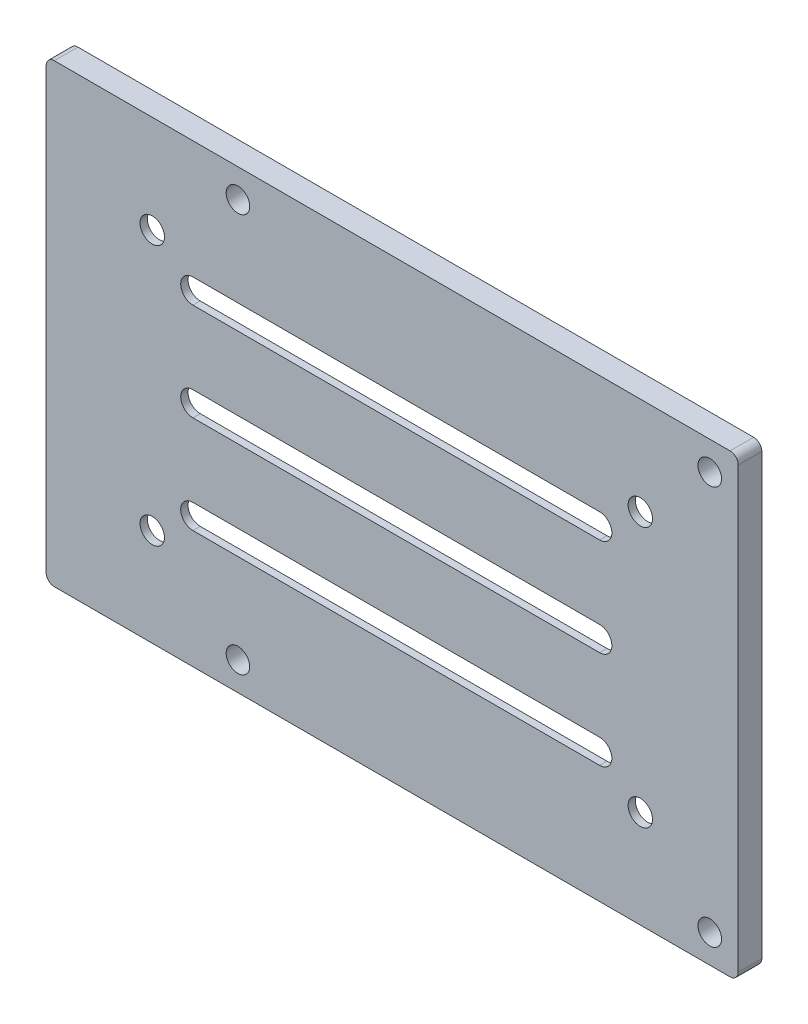
from build123d import *

# Parameters (mm, degrees)
SKETCH1_W           = 85.073492716
SKETCH1_H           = 56
SKETCH1_R           = 1.45
SKETCH1_R_2         = 1.444439883
BOSS_EXTRUDE2_DEPTH = 2.9
FILLET1_R           = 1
SKETCH2_W           = 74.073492716
SKETCH2_H           = 42
CUT_EXTRUDE1_DEPTH  = 2
SKETCH3_R           = 1.5
CUT_EXTRUDE2_DEPTH  = 13


with BuildPart() as part:
    # Sketch1 → Boss-Extrude2 (new body)
    with BuildSketch(Plane.XY):
        with Locations((0.5, -16.452272815)):
            Rectangle(SKETCH1_W, SKETCH1_H)
        with Locations((39.536746358, 8.047727185)):
            Circle(SKETCH1_R, mode=Mode.SUBTRACT)
        with Locations((39.536746358, -40.952272815)):
            Circle(SKETCH1_R, mode=Mode.SUBTRACT)
        with Locations((-18.463253642, 8.047727185)):
            Circle(SKETCH1_R, mode=Mode.SUBTRACT)
        with Locations((-18.463253642, -40.952272815)):
            Circle(SKETCH1_R_2, mode=Mode.SUBTRACT)
    extrude(amount=BOSS_EXTRUDE2_DEPTH)

    # Fillet1
    fillet1_edges = [part.edges().sort_by_distance(p)[0] for p in [
        (-42.036746358, 11.547727185, 1.45),
        (43.036746358, 11.547727185, 1.45),
        (43.036746358, -44.452272815, 1.45),
        (-42.036746358, -44.452272815, 1.45),
    ]]
    fillet(fillet1_edges, radius=FILLET1_R)

    # Sketch2 → Cut-Extrude1 (cut)
    with BuildSketch(Plane(origin=(0, 0, 0), x_dir=(-1, 0, 0), z_dir=(0, 0, -1))):
        with Locations((-1, -16.452272815)):
            Rectangle(SKETCH2_W, SKETCH2_H)
    extrude(amount=-CUT_EXTRUDE1_DEPTH, mode=Mode.SUBTRACT)

    # Sketch3 → Cut-Extrude2 (cut)
    with BuildSketch(Plane(origin=(0, 0, 2), x_dir=(-1, 0, 0), z_dir=(0, 0, -1))):
        with Locations((-31, -0.452272815)):
            Circle(SKETCH3_R)
        with Locations((-31, -32.452272815)):
            Circle(SKETCH3_R)
        with Locations((29, -32.452272815)):
            Circle(SKETCH3_R)
        with Locations((29, -0.452272815)):
            Circle(SKETCH3_R)
        with BuildLine():
            Line((-26, -2.952272815), (24, -2.952272815))
            ThreePointArc((24, -2.952272815), (25.5, -4.452272815), (24, -5.952272815))
            Line((24, -5.952272815), (-26, -5.952272815))
            ThreePointArc((-26, -5.952272815), (-27.5, -4.452272815), (-26, -2.952272815))
        make_face()
        with BuildLine():
            Line((-26, -29.952272815), (24, -29.952272815))
            ThreePointArc((24, -29.952272815), (25.5, -28.452272815), (24, -26.952272815))
            Line((24, -26.952272815), (-26, -26.952272815))
            ThreePointArc((-26, -26.952272815), (-27.5, -28.452272815), (-26, -29.952272815))
        make_face()
        with BuildLine():
            Line((-26, -14.952272815), (24, -14.952272815))
            ThreePointArc((24, -14.952272815), (25.5, -16.452272815), (24, -17.952272815))
            Line((24, -17.952272815), (-26, -17.952272815))
            ThreePointArc((-26, -17.952272815), (-27.5, -16.452272815), (-26, -14.952272815))
        make_face()
    extrude(amount=-CUT_EXTRUDE2_DEPTH, mode=Mode.SUBTRACT)


solid = part.part
